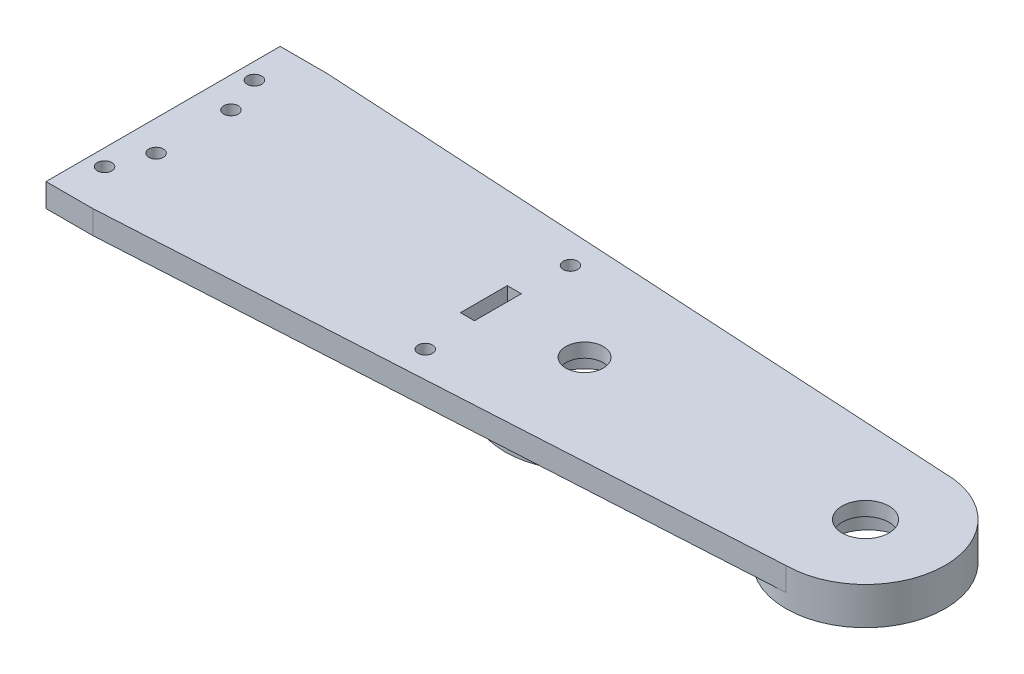
from build123d import *

# Parameters (mm, degrees)
SKETCH28_R           = 5
SKETCH28_R_2         = 4
SKETCH28_R_3         = 1.55
SKETCH28_W           = 10
SKETCH28_H           = 3
BOSS_EXTRUDE10_DEPTH = 5
SKETCH25_R           = 17
BOSS_EXTRUDE8_DEPTH  = 3
SKETCH30_R           = 17
BOSS_EXTRUDE11_DEPTH = 4
SKETCH32_R           = 9.7
CUT_EXTRUDE3_DEPTH   = 6
SKETCH33_R           = 8.2
CUT_EXTRUDE4_DEPTH   = 5


with BuildPart() as part:
    # Sketch28 → Boss-Extrude10 (new body)
    with BuildSketch(Plane(origin=(-32, 0, 0), x_dir=(0, 0, 1), z_dir=(0, -1, 0))):
        with BuildLine():
            Line((-25, 15), (25, 15))
            Line((25, 15), (25, 5))
            Line((25, 5), (17, -135))
            ThreePointArc((17, -135), (0, -152), (-17, -135))
            Line((-17, -135), (-25, 5))
            Line((-25, 5), (-25, 15))
        make_face()
        with Locations(Location((0, -135, 0), (0, 0, 180))):
            Circle(SKETCH28_R, mode=Mode.SUBTRACT)
        with Locations(Location((0, -75, 0), (0, 0, 180))):
            Circle(SKETCH28_R_2, mode=Mode.SUBTRACT)
        with Locations(Location((8, 8.5, 0), (0, 0, 180))):
            Circle(SKETCH28_R_3, mode=Mode.SUBTRACT)
        with Locations(Location((-8, 8.5, 0), (0, 0, 180))):
            Circle(SKETCH28_R_3, mode=Mode.SUBTRACT)
        with Locations(Location((16, 11.5, 0), (0, 0, 180))):
            Circle(SKETCH28_R_3, mode=Mode.SUBTRACT)
        with Locations(Location((-16, 11.5, 0), (0, 0, 180))):
            Circle(SKETCH28_R_3, mode=Mode.SUBTRACT)
        with Locations(Location((-15.5, -56.5, 0), (0, 0, 180))):
            Circle(SKETCH28_R_3, mode=Mode.SUBTRACT)
        with Locations(Location((15.5, -56.5, 0), (0, 0, 180))):
            Circle(SKETCH28_R_3, mode=Mode.SUBTRACT)
        with Locations((0, -55)):
            Rectangle(SKETCH28_W, SKETCH28_H, mode=Mode.SUBTRACT)
    extrude(amount=BOSS_EXTRUDE10_DEPTH)

    # Sketch25 → Boss-Extrude8 (add)
    with BuildSketch(Plane(origin=(0, -5, 0), x_dir=(0, 0, 1), z_dir=(0, -1, 0))):
        with Locations((0, -103)):
            Circle(SKETCH25_R)
    extrude(amount=BOSS_EXTRUDE8_DEPTH)

    # Sketch30 → Boss-Extrude11 (add)
    with BuildSketch(Plane(origin=(0, -5, 0), x_dir=(0, 0, 1), z_dir=(0, -1, 0))):
        with Locations((0, -43)):
            Circle(SKETCH30_R)
    extrude(amount=BOSS_EXTRUDE11_DEPTH)

    # Sketch32 → Cut-Extrude3 (cut)
    with BuildSketch(Plane.XZ.offset(9)):
        with Locations((43, 0)):
            Circle(SKETCH32_R)
    extrude(amount=-CUT_EXTRUDE3_DEPTH, mode=Mode.SUBTRACT)

    # Sketch33 → Cut-Extrude4 (cut)
    with BuildSketch(Plane.XZ.offset(8)):
        with Locations((103, -0.549344368)):
            Circle(SKETCH33_R)
    extrude(amount=-CUT_EXTRUDE4_DEPTH, mode=Mode.SUBTRACT)


solid = part.part
